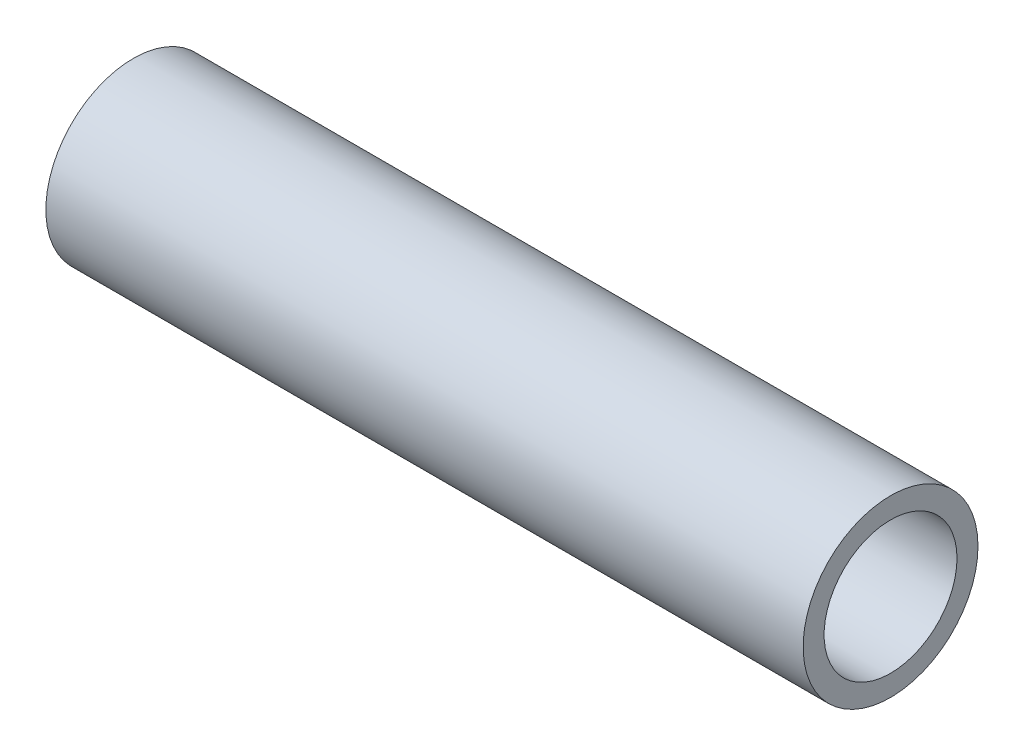
from build123d import *

# Parameters (mm, degrees)
SKETCH1_R           = 12.7
SKETCH1_R_2         = 9.652
BOSS_EXTRUDE1_DEPTH = 110


with BuildPart() as part:
    # Sketch1 → Boss-Extrude1 (new body)
    with BuildSketch(Plane(origin=(0, 0, 0), x_dir=(0, 0, -1), z_dir=(1, 0, 0))):
        Circle(SKETCH1_R)
        Circle(SKETCH1_R_2, mode=Mode.SUBTRACT)
    extrude(amount=BOSS_EXTRUDE1_DEPTH)


solid = part.part
